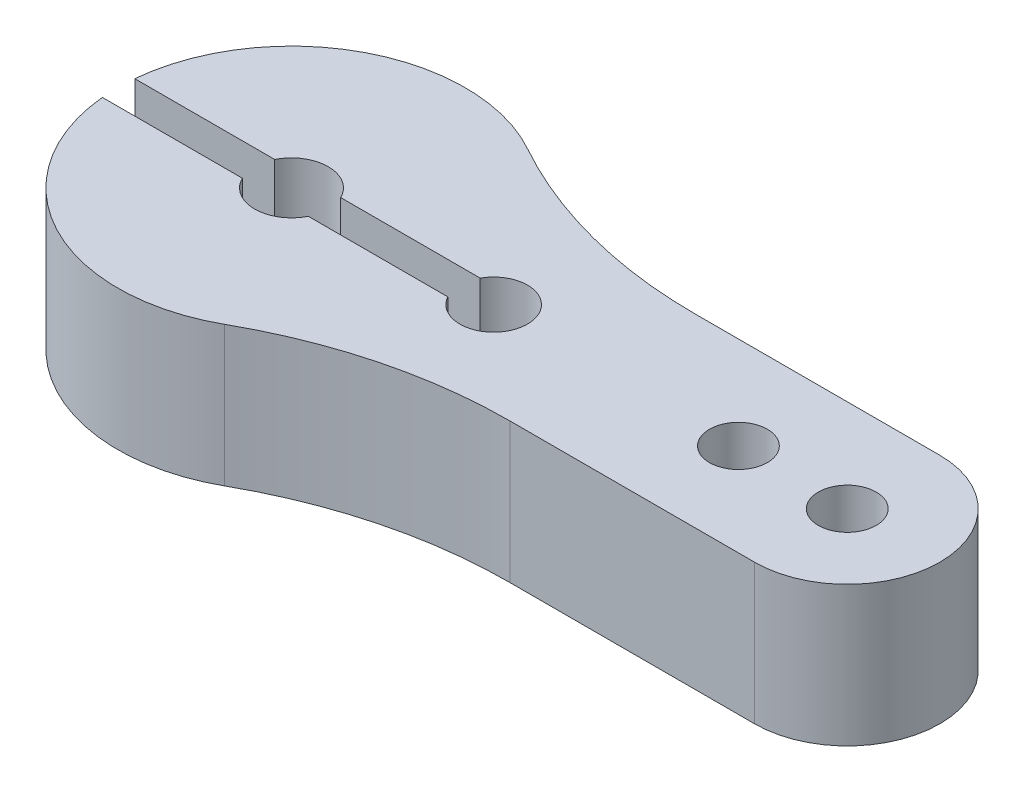
from build123d import *

# Parameters (mm, degrees)
BOSS_EXTRUDE1_DEPTH         = 6.0452
FILLET1_R                   = 20
TAP_DRILL_FOR_M3X0_5_TAP1_D = 2.5
CUT_EXTRUDE1_REACH          = 31.611
SKETCH6_R                   = 1.5875
SKETCH6_R_2                 = 1.4605
CUT_EXTRUDE2_START          = -6.0452
CUT_EXTRUDE2_DEPTH          = 6.0452


with BuildPart() as part:
    # Sketch1 → Boss-Extrude1 (new body)
    with BuildSketch(Plane(origin=(0, 0, 0), x_dir=(1, 0, 0), z_dir=(0, 1, 0))):
        with BuildLine():
            Line((6.34428877, -4), (24, -4))
            ThreePointArc((24, -4), (28, 0), (24, 4))
            Line((24, 4), (6.34428877, 4))
            ThreePointArc((6.34428877, 4), (-7.5, 0), (6.34428877, -4))
        make_face()
    extrude(amount=BOSS_EXTRUDE1_DEPTH)

    # Fillet1
    fillet1_edges = [part.edges().sort_by_distance(p)[0] for p in [
        (6.34428877, 3.0226, -4),
        (6.34428877, 3.0226, 4),
    ]]
    fillet(fillet1_edges, radius=FILLET1_R)

    # Tap Drill for M3x0.5 Tap1 (through all)
    with Locations(Plane(origin=(0, 6.0452, 0), x_dir=(1, 0, 0), z_dir=(0, 1, 0))):
        with Locations((19.301, 0), (24, 0)):
            Hole(TAP_DRILL_FOR_M3X0_5_TAP1_D / 2)

    # Sketch6 → Cut-Extrude1 (cut, up to next)
    with BuildSketch(Plane(origin=(0, 6.0452, 0), x_dir=(1, 0, 0), z_dir=(0, 1, 0)), mode=Mode.PRIVATE) as cut_extrude1_sk1:
        with Locations(Location((0, 0, 0), (0, 0, 270))):
            Circle(SKETCH6_R)
    cut_extrude1_tool1 = extrude(cut_extrude1_sk1.sketch, amount=-CUT_EXTRUDE1_REACH, mode=Mode.PRIVATE) & part.part
    # Sketch6 → Cut-Extrude1 (cut, up to next)
    with BuildSketch(Plane(origin=(0, 6.0452, 0), x_dir=(1, 0, 0), z_dir=(0, 1, 0)), mode=Mode.PRIVATE) as cut_extrude1_sk2:
        with Locations(Location((8.731458325, 0, 0), (0, 0, 270))):
            Circle(SKETCH6_R_2)
    cut_extrude1_tool2 = extrude(cut_extrude1_sk2.sketch, amount=-CUT_EXTRUDE1_REACH, mode=Mode.PRIVATE) & part.part
    add(cut_extrude1_tool1.solids().sort_by_distance((0, 6.0452, 0))[0], mode=Mode.SUBTRACT)
    add(cut_extrude1_tool2.solids().sort_by_distance((8.731458, 6.0452, 0))[0], mode=Mode.SUBTRACT)

    # Sketch7 → Cut-Extrude2 (cut)
    with BuildSketch(Plane(origin=(0, 6.0452, 0), x_dir=(1, 0, 0), z_dir=(0, 1, 0)).offset(CUT_EXTRUDE2_START)):
        with BuildLine():
            Line((7.449638443, 0.6999986), (-7.467262012, 0.6999986))
            ThreePointArc((-7.467262012, 0.6999986), (-7.5, -1.406e-06), (-7.46726175, -0.7000014))
            Line((-7.46726175, -0.7000014), (7.449639972, -0.7000014))
            ThreePointArc((7.449639972, -0.7000014), (7.270958325, -1.595e-06), (7.449638443, 0.6999986))
        make_face()
    extrude(amount=CUT_EXTRUDE2_DEPTH, mode=Mode.SUBTRACT)


solid = part.part
